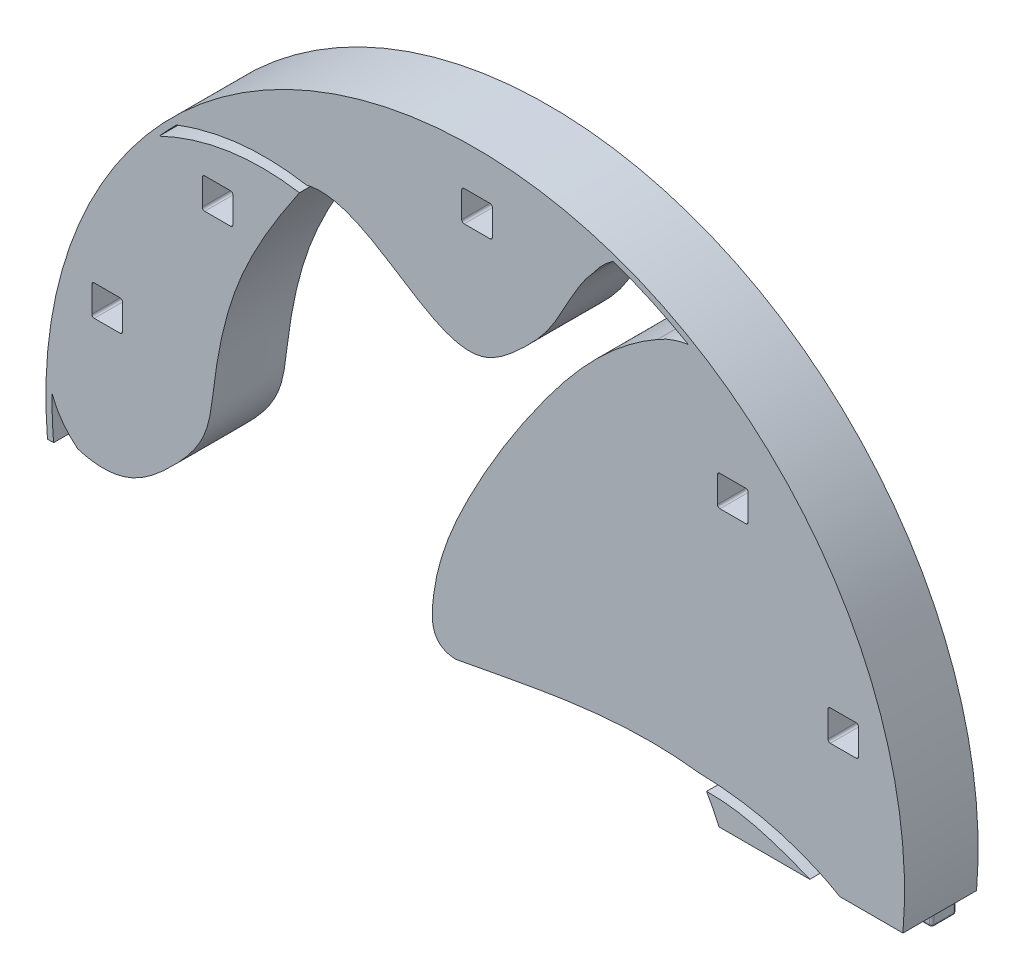
from build123d import *

# Parameters (mm, degrees)
SKETCH2_R           = 88.9
BOSS_EXTRUDE1_DEPTH = 7.62
CUT_EXTRUDE1_DEPTH  = 5.08
CUT_EXTRUDE2_DEPTH  = 5.08
SKETCH6_R           = 88.9
SKETCH6_R_2         = 87.63
BOSS_EXTRUDE2_DEPTH = 7.62
SKETCH5_W           = 447.85569709
SKETCH5_H           = 96.634651294
CUT_EXTRUDE3_DEPTH  = 132.443466321
BOSS_EXTRUDE3_DEPTH = 3.81
FILLET1_R           = 0.508
CUT_EXTRUDE4_DEPTH  = 6.604


with BuildPart() as part:
    # Sketch2 → Boss-Extrude1 (new, symmetric)
    with BuildSketch(Plane.XY):
        with Locations(Location((0, 0, 0), (0, 0, 180))):
            Circle(SKETCH2_R)
        with BuildLine():
            ThreePointArc((-82.315247566, -6.2211348), (-81.828164186, -10.892843798), (-81.076160162, -15.529286954))
            add(Edge.make_bspline(
                [(-81.076160162, -15.529286954), (-73.906972416, -10.329566502), (-59.046073895, -8.193381199), (-41.118812884, -7.621785306), (-29.401022662, -11.302114845), (-16.402067506, -22.130924736), (-22.534501322, -39.59705785), (-25.174662603, -47.236332112)],
                knots=[0, 0, 0, 0, 0.276571303, 0.483745751, 0.57530858, 0.672728071, 1, 1, 1, 1], degree=3))
            add(Edge.make_bspline(
                [(-25.174662603, -47.236332112), (-27.78260004, -55.688683624), (-25.255419914, -64.276124819)],
                knots=[0, 0, 0, 1, 1, 1], degree=2))
            add(Edge.make_bspline(
                [(-25.255419914, -64.276124819), (-19.568994185, -66.326395956), (-8.191864865, -67.179069199), (6.698062012, -62.452519029), (13.701149455, -53.656480208), (20.991800731, -49.374990358), (29.14906596, -47.7148715), (41.321609726, -51.605604), (49.118683791, -58.056687878), (49.804799161, -65.833004493)],
                knots=[0, 0, 0, 0, 0.203689327, 0.383928899, 0.501194003, 0.577509121, 0.667833303, 0.774874029, 1, 1, 1, 1], degree=3))
            ThreePointArc((49.804799161, -65.833004493), (53.727997634, -62.672200937), (57.451073953, -59.277960505))
            add(Edge.make_bspline(
                [(57.451073953, -59.277960505), (56.756918153, -39.692420945), (57.937164009, -17.253163459), (46.295557994, 0)],
                knots=[0, 0, 0, 0, 1, 1, 1, 1], degree=3))
            add(Edge.make_bspline(
                [(46.295557994, 0), (29.352418178, 2.160827537), (12.476860977, -1.829953153), (-4.097004325, -4.838743622)],
                knots=[0, 0, 0, 0, 1, 1, 1, 1], degree=3))
            add(Edge.make_bspline(
                [(-4.097004325, -4.838743622), (-9.003253572, -4.538646122), (-9.174496671, 2.827576235), (-6.823743398, 13.979544817), (0.460919685, 29.784330466), (13.972068662, 51.572454476), (27.394543454, 67.53561229), (37.735282985, 73.420371274)],
                knots=[0, 0, 0, 0, 0.104628163, 0.200082966, 0.362713634, 0.636377303, 1, 1, 1, 1], degree=3))
            ThreePointArc((37.735282985, 73.420371274), (31.253924322, 76.40480819), (24.539050502, 78.818383011))
            add(Edge.make_bspline(
                [(24.539050502, 78.818383011), (20.455603408, 74.411727836), (17.564971871, 65.824999318), (9.51286746, 57.448673309), (-6.264292968, 43.842012074), (-22.034432487, 67.881542589), (-34.946297284, 64.774058813)],
                knots=[0, 0, 0, 0, 0.241588619, 0.345090174, 0.475626468, 1, 1, 1, 1], degree=3))
            add(Edge.make_bspline(
                [(-34.946297284, 64.774058813), (-40.534107409, 56.654806295), (-49.826434679, 42.328020188), (-53.897482917, 22.922904088), (-55.122078377, 8.697330529), (-64.97763294, -2.490084084), (-73.627608697, -8.872135806), (-82.315247566, -6.2211348)],
                knots=[0, 0, 0, 0, 0.32342158, 0.539679085, 0.642017351, 0.776511597, 1, 1, 1, 1], degree=3))
        make_face(mode=Mode.SUBTRACT)
    extrude(amount=BOSS_EXTRUDE1_DEPTH, both=True)

    # Sketch3 → Cut-Extrude1 (cut)
    with BuildSketch(Plane.XY.offset(7.62)):
        with BuildLine():
            ThreePointArc((45.031224335, -76.651150251), (52.423489091, -71.798243652), (59.297063103, -66.23494778))
            add(Edge.make_bspline(
                [(57.451073953, -59.277960505), (56.590081261, -63.222807516), (59.297063103, -66.23494778)],
                knots=[0, 0, 0, 1, 1, 1], degree=2))
            ThreePointArc((57.451073953, -59.277960505), (53.727997634, -62.672200937), (49.804799161, -65.833004493))
            add(Edge.make_bspline(
                [(49.804799161, -65.833004493), (50.290836256, -72.182369469), (45.031224335, -76.651150251)],
                knots=[0, 0, 0, 1, 1, 1], degree=2))
        make_face()
        with BuildLine():
            ThreePointArc((-88.68252483, 6.214482268), (-88.635767577, -6.849139077), (-86.675026694, -19.764861438))
            add(Edge.make_bspline(
                [(-81.076160162, -15.529286954), (-84.185623479, -17.238401337), (-86.675026694, -19.764861438)],
                knots=[0, 0, 0, 1, 1, 1], degree=2))
            ThreePointArc((-81.076160162, -15.529286954), (-81.828164186, -10.892843798), (-82.315247566, -6.2211348))
            add(Edge.make_bspline(
                [(-82.315247566, -6.2211348), (-88.132024584, -1.499163565), (-88.68252483, 6.214482268)],
                knots=[0, 0, 0, 1, 1, 1], degree=2))
        make_face()
        with BuildLine():
            ThreePointArc((46.295557994, 75.894211308), (38.302929005, 80.22528049), (29.909783679, 83.717470341))
            add(Edge.make_bspline(
                [(24.539050502, 78.818383011), (26.687958515, 81.902861564), (29.909783679, 83.717470341)],
                knots=[0, 0, 0, 1, 1, 1], degree=2))
            ThreePointArc((24.539050502, 78.818383011), (31.253924322, 76.40480819), (37.735282985, 73.420371274))
            add(Edge.make_bspline(
                [(37.735282985, 73.420371274), (41.692258874, 75.781578849), (46.295557994, 75.894211308)],
                knots=[0, 0, 0, 1, 1, 1], degree=2))
        make_face()
    extrude(amount=-CUT_EXTRUDE1_DEPTH, mode=Mode.SUBTRACT)

    # Sketch4 → Cut-Extrude2 (cut)
    with BuildSketch(Plane.XY.offset(7.62)):
        with BuildLine():
            add(Edge.make_bspline(
                [(47.900635375, -2.546062133), (47.394653083, -1.68578683), (46.860186189, -0.836793698), (46.295557994, 0)],
                knots=[0.951499115, 0.951499115, 0.951499115, 0.951499115, 1, 1, 1, 1], degree=3))
            add(Edge.make_bspline(
                [(46.295557994, 0), (53.13831993, -0.121479856), (68.560923547, -2.55317749), (82.330777435, -11.060245422), (86.920742606, -18.654610819)],
                knots=[0, 0, 0, 0, 0.442007256, 1, 1, 1, 1], degree=3))
            ThreePointArc((86.920742606, -18.654610819), (86.48950366, -20.561511535), (86.016435709, -22.458468066))
            add(Edge.make_bspline(
                [(47.900635375, -2.546062133), (54.105200197, -2.383601891), (68.545991377, -6.411725997), (82.278778054, -13.661239618), (86.016435709, -22.458468066)],
                knots=[0, 0, 0, 0, 0.409341375, 1, 1, 1, 1], degree=3))
        make_face()
        with BuildLine():
            add(Edge.make_bspline(
                [(-25.255419914, -64.276124819), (-24.329796264, -64.609863365), (-23.39490974, -64.901263139), (-22.452232953, -65.15178529)],
                knots=[0, 0, 0, 0, 0.033156093, 0.033156093, 0.033156093, 0.033156093], degree=3))
            add(Edge.make_bspline(
                [(-22.452232953, -65.15178529), (-17.435167734, -76.286545317), (-6.016270367, -83.097855064), (4.238511489, -88.798902135)],
                knots=[0, 0, 0, 0, 1, 1, 1, 1], degree=3))
            ThreePointArc((4.238511489, -88.798902135), (2.435652007, -88.866628153), (0.631789417, -88.897754989))
            add(Edge.make_bspline(
                [(-25.255419914, -64.276124819), (-21.127783836, -75.858222766), (-10.467359196, -84.393639797), (0.631789417, -88.897754989)],
                knots=[0, 0, 0, 0, 1, 1, 1, 1], degree=3))
        make_face()
        with BuildLine():
            add(Edge.make_bspline(
                [(-34.946297284, 64.774058813), (-50.35182607, 67.382365169), (-64.84460315, 60.814368716)],
                knots=[0, 0, 0, 1, 1, 1], degree=2))
            ThreePointArc((-64.84460315, 60.814368716), (-66.672342804, 58.804835729), (-68.43783363, 56.740399435))
            add(Edge.make_bspline(
                [(-35.097283324, 62.444599517), (-52.424851341, 65.607841777), (-68.43783363, 56.740399435)],
                knots=[0, 0, 0, 1, 1, 1], degree=2))
            Line((-35.097283324, 62.444599517), (-34.946297284, 64.774058813))
        make_face()
    extrude(amount=-CUT_EXTRUDE2_DEPTH, mode=Mode.SUBTRACT)

    # Sketch6 → Boss-Extrude2 (add, symmetric)
    with BuildSketch(Plane.XY):
        with Locations(Location((0, 0, 0), (0, 0, 180))):
            Circle(SKETCH6_R)
        Circle(SKETCH6_R_2, mode=Mode.SUBTRACT)
    extrude(amount=BOSS_EXTRUDE2_DEPTH, both=True)

    # Sketch5 → Cut-Extrude3 (cut, through all)
    with BuildSketch(Plane(origin=(0, -7.62, 0), x_dir=(1, 0, 0), z_dir=(0, 1, 0))):
        Rectangle(SKETCH5_W, SKETCH5_H)
    extrude(amount=-CUT_EXTRUDE3_DEPTH, mode=Mode.SUBTRACT)

    # Sketch7 → Boss-Extrude3 (add)
    with BuildSketch(Plane.XZ.offset(7.62)):
        with BuildLine():
            Line((-86.401190925, 0), (-84.369190925, 0))
            ThreePointArc((-84.369190925, 0), (-84.00998068, -0.148789755), (-83.861190925, -0.508))
            Line((-83.861190925, -0.508), (-83.861190925, -4.572))
            ThreePointArc((-83.861190925, -4.572), (-84.00998068, -4.931210245), (-84.369190925, -5.08))
            Line((-84.369190925, -5.08), (-86.401190925, -5.08))
            ThreePointArc((-86.401190925, -5.08), (-86.760401169, -4.931210245), (-86.909190925, -4.572))
            Line((-86.909190925, -4.572), (-86.909190925, -0.508))
            ThreePointArc((-86.909190925, -0.508), (-86.760401169, -0.148789755), (-86.401190925, 0))
        make_face()
        with BuildLine():
            Line((86.909190925, -0.508), (86.909190925, -4.572))
            ThreePointArc((86.909190925, -4.572), (86.760401169, -4.931210245), (86.401190925, -5.08))
            Line((86.401190925, -5.08), (84.369190925, -5.08))
            ThreePointArc((84.369190925, -5.08), (84.00998068, -4.931210245), (83.861190925, -4.572))
            Line((83.861190925, -4.572), (83.861190925, -0.508))
            ThreePointArc((83.861190925, -0.508), (84.00998068, -0.148789755), (84.369190925, 0))
            Line((84.369190925, 0), (86.401190925, 0))
            ThreePointArc((86.401190925, 0), (86.760401169, -0.148789755), (86.909190925, -0.508))
        make_face()
    extrude(amount=BOSS_EXTRUDE3_DEPTH)

    # Fillet1
    fillet1_edges = [part.edges().sort_by_distance(p)[0] for p in [
        (86.760401169, -11.43, -0.148789755),
        (85.385190925, -11.43, 0),
        (84.00998068, -11.43, -0.148789755),
        (83.861190925, -11.43, -2.54),
        (84.00998068, -11.43, -4.931210245),
        (85.385190925, -11.43, -5.08),
        (86.760401169, -11.43, -4.931210245),
        (86.909190925, -11.43, -2.54),
        (-86.760401169, -11.43, -4.931210245),
        (-85.385190925, -11.43, -5.08),
        (-84.00998068, -11.43, -4.931210245),
        (-83.861190925, -11.43, -2.54),
        (-84.00998068, -11.43, -0.148789755),
        (-85.385190925, -11.43, 0),
        (-86.760401169, -11.43, -0.148789755),
        (-86.909190925, -11.43, -2.54),
    ]]
    fillet(fillet1_edges, radius=FILLET1_R)

    # Sketch11 → Cut-Extrude4 (cut)
    with BuildSketch(Plane.XY.offset(7.62)):
        with BuildLine():
            Line((-78.867, 25.250415913), (-73.533, 25.250415913))
            ThreePointArc((-73.533, 25.250415913), (-73.173789755, 25.101626158), (-73.025, 24.742415913))
            Line((-73.025, 24.742415913), (-73.025, 19.408415913))
            ThreePointArc((-73.025, 19.408415913), (-73.173789755, 19.049205668), (-73.533, 18.900415913))
            Line((-73.533, 18.900415913), (-78.867, 18.900415913))
            ThreePointArc((-78.867, 18.900415913), (-79.226210245, 19.049205668), (-79.375, 19.408415913))
            Line((-79.375, 19.408415913), (-79.375, 24.742415913))
            ThreePointArc((-79.375, 24.742415913), (-79.226210245, 25.101626158), (-78.867, 25.250415913))
        make_face()
        with BuildLine():
            Line((-56.007, 55.878718481), (-50.673, 55.878718481))
            ThreePointArc((-50.673, 55.878718481), (-50.313789755, 55.729928726), (-50.165, 55.370718481))
            Line((-50.165, 55.370718481), (-50.165, 50.036718481))
            ThreePointArc((-50.165, 50.036718481), (-50.313789755, 49.677508236), (-50.673, 49.528718481))
            Line((-50.673, 49.528718481), (-56.007, 49.528718481))
            ThreePointArc((-56.007, 49.528718481), (-56.366210245, 49.677508236), (-56.515, 50.036718481))
            Line((-56.515, 50.036718481), (-56.515, 55.370718481))
            ThreePointArc((-56.515, 55.370718481), (-56.366210245, 55.729928726), (-56.007, 55.878718481))
        make_face()
        with BuildLine():
            Line((-2.283833476, 80.482089488), (3.050166524, 80.482089488))
            ThreePointArc((3.050166524, 80.482089488), (3.409376768, 80.333299733), (3.558166524, 79.974089488))
            Line((3.558166524, 79.974089488), (3.558166524, 74.640089488))
            ThreePointArc((3.558166524, 74.640089488), (3.409376768, 74.280879244), (3.050166524, 74.132089488))
            Line((3.050166524, 74.132089488), (-2.283833476, 74.132089488))
            ThreePointArc((-2.283833476, 74.132089488), (-2.643043721, 74.280879244), (-2.791833476, 74.640089488))
            Line((-2.791833476, 74.640089488), (-2.791833476, 79.974089488))
            ThreePointArc((-2.791833476, 79.974089488), (-2.643043721, 80.333299733), (-2.283833476, 80.482089488))
        make_face()
        with BuildLine():
            Line((50.673, 55.878718481), (56.007, 55.878718481))
            ThreePointArc((56.007, 55.878718481), (56.366210245, 55.729928726), (56.515, 55.370718481))
            Line((56.515, 55.370718481), (56.515, 50.036718481))
            ThreePointArc((56.515, 50.036718481), (56.366210245, 49.677508236), (56.007, 49.528718481))
            Line((56.007, 49.528718481), (50.673, 49.528718481))
            ThreePointArc((50.673, 49.528718481), (50.313789755, 49.677508236), (50.165, 50.036718481))
            Line((50.165, 50.036718481), (50.165, 55.370718481))
            ThreePointArc((50.165, 55.370718481), (50.313789755, 55.729928726), (50.673, 55.878718481))
        make_face()
        with BuildLine():
            Line((73.533, 25.250415913), (78.867, 25.250415913))
            ThreePointArc((78.867, 25.250415913), (79.226210245, 25.101626158), (79.375, 24.742415913))
            Line((79.375, 24.742415913), (79.375, 19.408415913))
            ThreePointArc((79.375, 19.408415913), (79.226210245, 19.049205668), (78.867, 18.900415913))
            Line((78.867, 18.900415913), (73.533, 18.900415913))
            ThreePointArc((73.533, 18.900415913), (73.173789755, 19.049205668), (73.025, 19.408415913))
            Line((73.025, 19.408415913), (73.025, 24.742415913))
            ThreePointArc((73.025, 24.742415913), (73.173789755, 25.101626158), (73.533, 25.250415913))
        make_face()
    extrude(amount=-CUT_EXTRUDE4_DEPTH, mode=Mode.SUBTRACT)


solid = part.part
